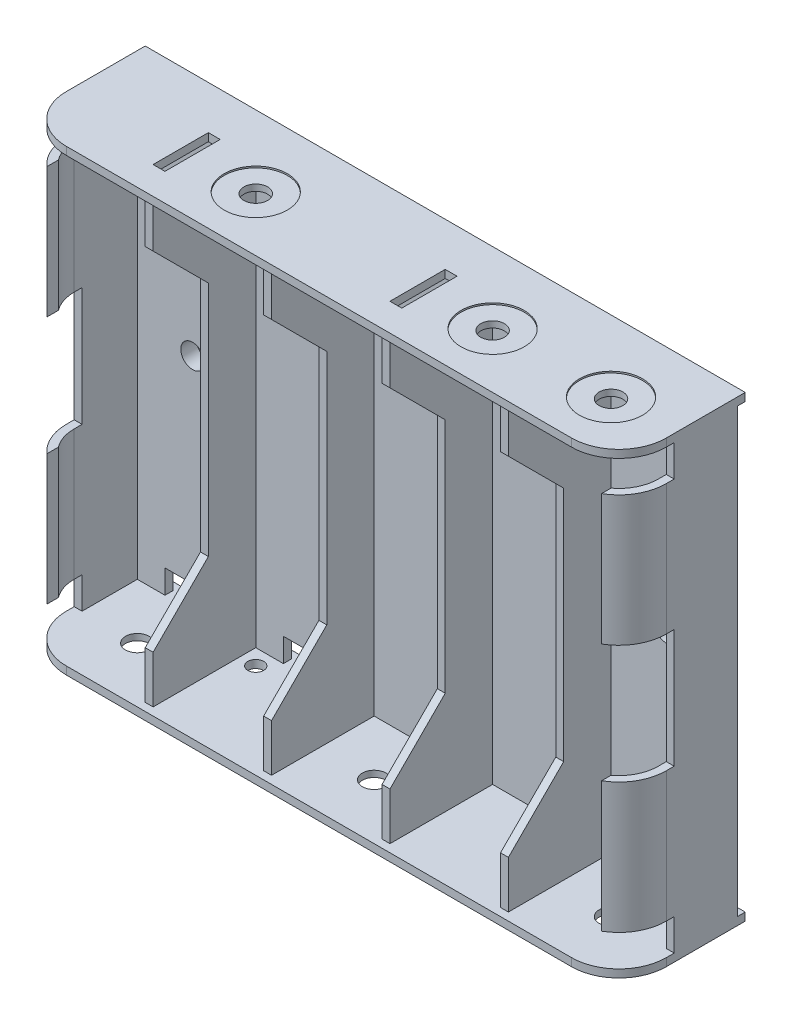
from build123d import *

# Parameters (mm, degrees)
ESQUISSE1_W              = 76
ESQUISSE1_H              = 58
BOSS_EXTRU_1_DEPTH       = 2
ESQUISSE3_W              = 1
ESQUISSE3_H              = 58
BOSS_EXTRU_2_DEPTH       = 13
ENL_V_MAT_EXTRU_2_REACH  = 87.499
ESQUISSE5_W              = 1
ESQUISSE5_H              = 58
BOSS_EXTRU_3_DEPTH       = 13
ENL_V_MAT_EXTRU_3_REACH  = 77.531
ESQUISSE7_W              = 1
ESQUISSE7_H              = 58
BOSS_EXTRU_4_DEPTH       = 13
ENL_V_MAT_EXTRU_4_REACH  = 76.927
ESQUISSE9_W              = 1
ESQUISSE9_H              = 58
BOSS_EXTRU_5_DEPTH       = 13
ENL_V_MAT_EXTRU_5_REACH  = 86.788
ESQUISSE11_W             = 76
ESQUISSE11_H             = 1
BOSS_EXTRU_6_DEPTH       = 14
ESQUISSE12_W             = 76
ESQUISSE12_H             = 1
BOSS_EXTRU_7_DEPTH       = 14
ENL_V_MAT_EXTRU_6_REACH  = 98.933
ENL_V_MAT_EXTRU_7_REACH  = 98.933
ENL_V_MAT_EXTRU_8_REACH  = 98.933
ENL_V_MAT_EXTRU_9_REACH  = 98.933
ESQUISSE18_W             = 76
ESQUISSE18_H             = 56
ENL_V_MAT_EXTRU_10_DEPTH = 1
ESQUISSE19_W             = 1
ESQUISSE19_H             = 56
BOSS_EXTRU_8_DEPTH       = 8
ESQUISSE20_W             = 1
ESQUISSE20_H             = 56
BOSS_EXTRU_9_DEPTH       = 8
BOSS_EXTRU_10_REACH      = 98.338
BOSS_EXTRU_11_REACH      = 98.338
ESQUISSE23_W             = 4
ESQUISSE23_H             = 56
ENL_V_MAT_EXTRU_11_DEPTH = 5
ESQUISSE24_W             = 4
ESQUISSE24_H             = 56
ENL_V_MAT_EXTRU_12_DEPTH = 5
ESQUISSE25_W             = 5.472135955
ESQUISSE25_H             = 4
ESQUISSE25_H_2           = 15
ENL_V_MAT_EXTRU_13_DEPTH = 5
ESQUISSE26_W             = 6.196152423
ESQUISSE26_H             = 4
ESQUISSE26_H_2           = 15
ENL_V_MAT_EXTRU_14_DEPTH = 5
ENL_V_MAT_EXTRU_15_REACH = 98.773
ESQUISSE27_R             = 1.5
ESQUISSE28_R             = 2.5
BOSS_EXTRU_12_DEPTH      = 1
ENL_V_MAT_EXTRU_16_REACH = 98.933
ESQUISSE29_R             = 1.5
ENL_V_MAT_EXTRU_17_REACH = 98.773
ESQUISSE30_W             = 7
ESQUISSE30_H             = 3
BOSS_EXTRU_13_DEPTH      = 1
ENL_V_MAT_EXTRU_18_REACH = 98.933
ESQUISSE32_R             = 1
ESQUISSE33_R             = 4
ENL_V_MAT_EXTRU_19_DEPTH = 0.2
ENL_V_START              = -0.2
ESQUISSE34_R             = 4
ENL_V_MAT_EXTRU_20_DEPTH = 0.2
ENL_V_MAT_EXTRU_21_REACH = 98.813
ESQUISSE35_R             = 1.5
ENL_V_MAT_EXTRU_22_REACH = 98.813
ESQUISSE36_R             = 1.5
ENL_V_MAT_EXTRU_23_REACH = 98.933
ESQUISSE37_W             = 2
ESQUISSE37_H             = 7
ENL_V_MAT_EXTRU_24_REACH = 98.933
ESQUISSE38_W             = 1.5
ESQUISSE38_H             = 7


with BuildPart() as part:
    # Esquisse1 → Boss.-Extru.1 (new body)
    with BuildSketch(Plane.XY):
        with Locations((38, 29)):
            Rectangle(ESQUISSE1_W, ESQUISSE1_H)
    extrude(amount=BOSS_EXTRU_1_DEPTH)

    # Esquisse3 → Boss.-Extru.2 (add)
    with BuildSketch(Plane.XY.offset(2)):
        with Locations((15.5, 29)):
            Rectangle(ESQUISSE3_W, ESQUISSE3_H)
    extrude(amount=BOSS_EXTRU_2_DEPTH)

    # Esquisse4 → Enlèv. mat.-Extru.2 (cut, up to next)
    with BuildSketch(Plane.ZY.offset(-15), mode=Mode.PRIVATE) as enl_v_mat_extru_2_sk1:
        Polygon((15, 51), (8, 44), (8, 14), (15, 7), align=None)
    enl_v_mat_extru_2_tool1 = extrude(enl_v_mat_extru_2_sk1.sketch, amount=-ENL_V_MAT_EXTRU_2_REACH, mode=Mode.PRIVATE) & part.part
    add(enl_v_mat_extru_2_tool1.solids().sort_by_distance((15, 29, 11.720721))[0], mode=Mode.SUBTRACT)

    # Esquisse5 → Boss.-Extru.3 (add)
    with BuildSketch(Plane.XY.offset(2)):
        with Locations((30.5, 29)):
            Rectangle(ESQUISSE5_W, ESQUISSE5_H)
    extrude(amount=BOSS_EXTRU_3_DEPTH)

    # Esquisse6 → Enlèv. mat.-Extru.3 (cut, up to next)
    with BuildSketch(Plane.ZY.offset(-30), mode=Mode.PRIVATE) as enl_v_mat_extru_3_sk1:
        Polygon((15, 51), (8, 44), (8, 14), (15, 7), align=None)
    enl_v_mat_extru_3_tool1 = extrude(enl_v_mat_extru_3_sk1.sketch, amount=-ENL_V_MAT_EXTRU_3_REACH, mode=Mode.PRIVATE) & part.part
    add(enl_v_mat_extru_3_tool1.solids().sort_by_distance((30, 29, 11.720721))[0], mode=Mode.SUBTRACT)

    # Esquisse7 → Boss.-Extru.4 (add)
    with BuildSketch(Plane.XY.offset(2)):
        with Locations((45.5, 29)):
            Rectangle(ESQUISSE7_W, ESQUISSE7_H)
    extrude(amount=BOSS_EXTRU_4_DEPTH)

    # Esquisse8 → Enlèv. mat.-Extru.4 (cut, up to next)
    with BuildSketch(Plane.ZY.offset(-45), mode=Mode.PRIVATE) as enl_v_mat_extru_4_sk1:
        Polygon((15, 51), (8, 44), (8, 14), (15, 7), align=None)
    enl_v_mat_extru_4_tool1 = extrude(enl_v_mat_extru_4_sk1.sketch, amount=-ENL_V_MAT_EXTRU_4_REACH, mode=Mode.PRIVATE) & part.part
    add(enl_v_mat_extru_4_tool1.solids().sort_by_distance((45, 29, 11.720721))[0], mode=Mode.SUBTRACT)

    # Esquisse9 → Boss.-Extru.5 (add)
    with BuildSketch(Plane.XY.offset(2)):
        with Locations((60.5, 29)):
            Rectangle(ESQUISSE9_W, ESQUISSE9_H)
    extrude(amount=BOSS_EXTRU_5_DEPTH)

    # Esquisse10 → Enlèv. mat.-Extru.5 (cut, up to next)
    with BuildSketch(Plane.ZY.offset(-60), mode=Mode.PRIVATE) as enl_v_mat_extru_5_sk1:
        Polygon((15, 51), (8, 44), (8, 14), (15, 7), align=None)
    enl_v_mat_extru_5_tool1 = extrude(enl_v_mat_extru_5_sk1.sketch, amount=-ENL_V_MAT_EXTRU_5_REACH, mode=Mode.PRIVATE) & part.part
    add(enl_v_mat_extru_5_tool1.solids().sort_by_distance((60, 29, 11.720721))[0], mode=Mode.SUBTRACT)

    # Esquisse11 → Boss.-Extru.6 (add)
    with BuildSketch(Plane.XY.offset(2)):
        with Locations((38, 0.5)):
            Rectangle(ESQUISSE11_W, ESQUISSE11_H)
    extrude(amount=BOSS_EXTRU_6_DEPTH)

    # Esquisse12 → Boss.-Extru.7 (add)
    with BuildSketch(Plane.XY.offset(2)):
        with Locations((38, 57.5)):
            Rectangle(ESQUISSE12_W, ESQUISSE12_H)
    extrude(amount=BOSS_EXTRU_7_DEPTH)

    # Esquisse13 → Enlèv. mat.-Extru.6 (cut, up to next)
    with BuildSketch(Plane.XZ, mode=Mode.PRIVATE) as enl_v_mat_extru_6_sk1:
        with BuildLine():
            Line((70, 16), (76, 16))
            Line((76, 16), (76, 10))
            ThreePointArc((76, 10), (74.242640687, 14.242640687), (70, 16))
        make_face()
    enl_v_mat_extru_6_tool1 = extrude(enl_v_mat_extru_6_sk1.sketch, amount=-ENL_V_MAT_EXTRU_6_REACH, mode=Mode.PRIVATE) & part.part
    add(enl_v_mat_extru_6_tool1.solids().sort_by_distance((74.659792, 0, 14.659792))[0], mode=Mode.SUBTRACT)

    # Esquisse14 → Enlèv. mat.-Extru.7 (cut, up to next)
    with BuildSketch(Plane.XZ, mode=Mode.PRIVATE) as enl_v_mat_extru_7_sk1:
        with BuildLine():
            Line((6, 16), (0, 16))
            Line((0, 16), (0, 10))
            ThreePointArc((0, 10), (1.757359313, 14.242640687), (6, 16))
        make_face()
    enl_v_mat_extru_7_tool1 = extrude(enl_v_mat_extru_7_sk1.sketch, amount=-ENL_V_MAT_EXTRU_7_REACH, mode=Mode.PRIVATE) & part.part
    add(enl_v_mat_extru_7_tool1.solids().sort_by_distance((1.340208, 0, 14.659792))[0], mode=Mode.SUBTRACT)

    # Esquisse15 → Enlèv. mat.-Extru.8 (cut, up to next)
    with BuildSketch(Plane(origin=(0, 58, 0), x_dir=(1, 0, 0), z_dir=(0, 1, 0)), mode=Mode.PRIVATE) as enl_v_mat_extru_8_sk1:
        with BuildLine():
            Line((0, -10), (0, -16))
            Line((0, -16), (6, -16))
            ThreePointArc((6, -16), (1.757359313, -14.242640687), (0, -10))
        make_face()
    enl_v_mat_extru_8_tool1 = extrude(enl_v_mat_extru_8_sk1.sketch, amount=-ENL_V_MAT_EXTRU_8_REACH, mode=Mode.PRIVATE) & part.part
    add(enl_v_mat_extru_8_tool1.solids().sort_by_distance((1.340208, 58, 14.659792))[0], mode=Mode.SUBTRACT)

    # Esquisse17 → Enlèv. mat.-Extru.9 (cut, up to next)
    with BuildSketch(Plane(origin=(0, 58, 0), x_dir=(1, 0, 0), z_dir=(0, 1, 0)), mode=Mode.PRIVATE) as enl_v_mat_extru_9_sk1:
        with BuildLine():
            Line((70, -16), (76, -16))
            Line((76, -16), (76, -10))
            ThreePointArc((76, -10), (74.242640687, -14.242640687), (70, -16))
        make_face()
    enl_v_mat_extru_9_tool1 = extrude(enl_v_mat_extru_9_sk1.sketch, amount=-ENL_V_MAT_EXTRU_9_REACH, mode=Mode.PRIVATE) & part.part
    add(enl_v_mat_extru_9_tool1.solids().sort_by_distance((74.659792, 58, 14.659792))[0], mode=Mode.SUBTRACT)

    # Esquisse18 → Enlèv. mat.-Extru.10 (cut)
    with BuildSketch(Plane(origin=(0, 0, 0), x_dir=(-1, 0, 0), z_dir=(0, 0, -1))):
        with Locations((-38, 29)):
            Rectangle(ESQUISSE18_W, ESQUISSE18_H)
    extrude(amount=-ENL_V_MAT_EXTRU_10_DEPTH, mode=Mode.SUBTRACT)

    # Esquisse19 → Boss.-Extru.8 (add)
    with BuildSketch(Plane.XY.offset(2)):
        with Locations((75.5, 29)):
            Rectangle(ESQUISSE19_W, ESQUISSE19_H)
    extrude(amount=BOSS_EXTRU_8_DEPTH)

    # Esquisse20 → Boss.-Extru.9 (add)
    with BuildSketch(Plane.XY.offset(2)):
        with Locations((0.5, 29)):
            Rectangle(ESQUISSE20_W, ESQUISSE20_H)
    extrude(amount=BOSS_EXTRU_9_DEPTH)

    # Esquisse21 → Boss.-Extru.10 (add, up to next)
    with BuildSketch(Plane.XZ.offset(-57), mode=Mode.PRIVATE) as boss_extru_10_sk1:
        with BuildLine():
            Line((6, 15), (6, 16))
            ThreePointArc((6, 16), (1.757359313, 14.242640687), (0, 10))
            Line((0, 10), (1, 10))
            ThreePointArc((1, 10), (2.464466094, 13.535533906), (6, 15))
        make_face()
    boss_extru_10_tool1 = extrude(boss_extru_10_sk1.sketch, amount=BOSS_EXTRU_10_REACH, mode=Mode.PRIVATE) - part.part
    add(boss_extru_10_tool1.solids().sort_by_distance((0.5, 57, 10.084853))[0])

    # Esquisse22 → Boss.-Extru.11 (add, up to next)
    with BuildSketch(Plane(origin=(0, 1, 0), x_dir=(1, 0, 0), z_dir=(0, 1, 0)), mode=Mode.PRIVATE) as boss_extru_11_sk1:
        with BuildLine():
            Line((70, -16), (70, -15))
            ThreePointArc((70, -15), (73.535533906, -13.535533906), (75, -10))
            Line((75, -10), (76, -10))
            ThreePointArc((76, -10), (74.242640687, -14.242640687), (70, -16))
        make_face()
    boss_extru_11_tool1 = extrude(boss_extru_11_sk1.sketch, amount=BOSS_EXTRU_11_REACH, mode=Mode.PRIVATE) - part.part
    add(boss_extru_11_tool1.solids().sort_by_distance((74.182641, 1, 14.182641))[0])

    # Esquisse23 → Enlèv. mat.-Extru.11 (cut)
    with BuildSketch(Plane.XY.offset(16)):
        with Locations((71, 29)):
            Rectangle(ESQUISSE23_W, ESQUISSE23_H)
    extrude(amount=-ENL_V_MAT_EXTRU_11_DEPTH, mode=Mode.SUBTRACT)

    # Esquisse24 → Enlèv. mat.-Extru.12 (cut)
    with BuildSketch(Plane.XY.offset(16)):
        with Locations((4, 29)):
            Rectangle(ESQUISSE24_W, ESQUISSE24_H)
    extrude(amount=-ENL_V_MAT_EXTRU_12_DEPTH, mode=Mode.SUBTRACT)

    # Esquisse25 → Enlèv. mat.-Extru.13 (cut)
    with BuildSketch(Plane.ZY):
        with Locations((11.736067977, 55)):
            Rectangle(ESQUISSE25_W, ESQUISSE25_H)
        with Locations((11.736067977, 29)):
            Rectangle(ESQUISSE25_W, ESQUISSE25_H_2)
        with Locations((11.736067977, 3)):
            Rectangle(ESQUISSE25_W, ESQUISSE25_H)
    extrude(amount=-ENL_V_MAT_EXTRU_13_DEPTH, mode=Mode.SUBTRACT)

    # Esquisse26 → Enlèv. mat.-Extru.14 (cut)
    with BuildSketch(Plane(origin=(76, 0, 0), x_dir=(0, 0, -1), z_dir=(1, 0, 0))):
        with Locations((-12.098076212, 55)):
            Rectangle(ESQUISSE26_W, ESQUISSE26_H)
        with Locations((-12.098076212, 29)):
            Rectangle(ESQUISSE26_W, ESQUISSE26_H_2)
        with Locations((-12.098076212, 3)):
            Rectangle(ESQUISSE26_W, ESQUISSE26_H)
    extrude(amount=-ENL_V_MAT_EXTRU_14_DEPTH, mode=Mode.SUBTRACT)

    # Esquisse27 → Enlèv. mat.-Extru.15 (cut, up to next)
    with BuildSketch(Plane(origin=(0, 0, 1), x_dir=(-1, 0, 0), z_dir=(0, 0, -1)), mode=Mode.PRIVATE) as enl_v_mat_extru_15_sk1:
        with Locations((-68, 29)):
            Circle(ESQUISSE27_R)
    enl_v_mat_extru_15_tool1 = extrude(enl_v_mat_extru_15_sk1.sketch, amount=-ENL_V_MAT_EXTRU_15_REACH, mode=Mode.PRIVATE) & part.part
    # Esquisse27 → Enlèv. mat.-Extru.15 (cut, up to next)
    with BuildSketch(Plane(origin=(0, 0, 1), x_dir=(-1, 0, 0), z_dir=(0, 0, -1)), mode=Mode.PRIVATE) as enl_v_mat_extru_15_sk2:
        with Locations((-8, 29)):
            Circle(ESQUISSE27_R)
    enl_v_mat_extru_15_tool2 = extrude(enl_v_mat_extru_15_sk2.sketch, amount=-ENL_V_MAT_EXTRU_15_REACH, mode=Mode.PRIVATE) & part.part
    add(enl_v_mat_extru_15_tool1.solids().sort_by_distance((68, 29, 1))[0], mode=Mode.SUBTRACT)
    add(enl_v_mat_extru_15_tool2.solids().sort_by_distance((8, 29, 1))[0], mode=Mode.SUBTRACT)

    # Esquisse28 → Boss.-Extru.12 (add)
    with BuildSketch(Plane(origin=(0, 0, 1), x_dir=(-1, 0, 0), z_dir=(0, 0, -1))):
        with Locations((-68, 29)):
            Circle(ESQUISSE28_R)
        with Locations((-8, 29)):
            Circle(ESQUISSE28_R)
    extrude(amount=BOSS_EXTRU_12_DEPTH)

    # Esquisse29 → Enlèv. mat.-Extru.16 (cut, up to next)
    with BuildSketch(Plane(origin=(0, 0, 0), x_dir=(-1, 0, 0), z_dir=(0, 0, -1)), mode=Mode.PRIVATE) as enl_v_mat_extru_16_sk1:
        with Locations((-68, 29)):
            Circle(ESQUISSE29_R)
    enl_v_mat_extru_16_tool1 = extrude(enl_v_mat_extru_16_sk1.sketch, amount=-ENL_V_MAT_EXTRU_16_REACH, mode=Mode.PRIVATE) & part.part
    # Esquisse29 → Enlèv. mat.-Extru.16 (cut, up to next)
    with BuildSketch(Plane(origin=(0, 0, 0), x_dir=(-1, 0, 0), z_dir=(0, 0, -1)), mode=Mode.PRIVATE) as enl_v_mat_extru_16_sk2:
        with Locations((-8, 29)):
            Circle(ESQUISSE29_R)
    enl_v_mat_extru_16_tool2 = extrude(enl_v_mat_extru_16_sk2.sketch, amount=-ENL_V_MAT_EXTRU_16_REACH, mode=Mode.PRIVATE) & part.part
    add(enl_v_mat_extru_16_tool1.solids().sort_by_distance((68, 29, 0))[0], mode=Mode.SUBTRACT)
    add(enl_v_mat_extru_16_tool2.solids().sort_by_distance((8, 29, 0))[0], mode=Mode.SUBTRACT)

    # Esquisse30 → Enlèv. mat.-Extru.17 (cut, up to next)
    with BuildSketch(Plane(origin=(0, 0, 1), x_dir=(-1, 0, 0), z_dir=(0, 0, -1)), mode=Mode.PRIVATE) as enl_v_mat_extru_17_sk1:
        with Locations((-68, 55.5)):
            Rectangle(ESQUISSE30_W, ESQUISSE30_H)
    enl_v_mat_extru_17_tool1 = extrude(enl_v_mat_extru_17_sk1.sketch, amount=-ENL_V_MAT_EXTRU_17_REACH, mode=Mode.PRIVATE) & part.part
    # Esquisse30 → Enlèv. mat.-Extru.17 (cut, up to next)
    with BuildSketch(Plane(origin=(0, 0, 1), x_dir=(-1, 0, 0), z_dir=(0, 0, -1)), mode=Mode.PRIVATE) as enl_v_mat_extru_17_sk2:
        with Locations((-8, 2.5)):
            Rectangle(ESQUISSE30_W, ESQUISSE30_H)
    enl_v_mat_extru_17_tool2 = extrude(enl_v_mat_extru_17_sk2.sketch, amount=-ENL_V_MAT_EXTRU_17_REACH, mode=Mode.PRIVATE) & part.part
    # Esquisse30 → Enlèv. mat.-Extru.17 (cut, up to next)
    with BuildSketch(Plane(origin=(0, 0, 1), x_dir=(-1, 0, 0), z_dir=(0, 0, -1)), mode=Mode.PRIVATE) as enl_v_mat_extru_17_sk3:
        with Locations((-23, 2.5)):
            Rectangle(ESQUISSE30_W, ESQUISSE30_H)
    enl_v_mat_extru_17_tool3 = extrude(enl_v_mat_extru_17_sk3.sketch, amount=-ENL_V_MAT_EXTRU_17_REACH, mode=Mode.PRIVATE) & part.part
    add(enl_v_mat_extru_17_tool1.solids().sort_by_distance((68, 55.5, 1))[0], mode=Mode.SUBTRACT)
    add(enl_v_mat_extru_17_tool2.solids().sort_by_distance((8, 2.5, 1))[0], mode=Mode.SUBTRACT)
    add(enl_v_mat_extru_17_tool3.solids().sort_by_distance((23, 2.5, 1))[0], mode=Mode.SUBTRACT)

    # Esquisse31 → Boss.-Extru.13 (add)
    with BuildSketch(Plane(origin=(0, 0, 1), x_dir=(-1, 0, 0), z_dir=(0, 0, -1))):
        Polygon((-21, 4), (-66, 54), (-64.654637595, 54), (-19.654637595, 4), align=None)
        Polygon((-22.345362405, 4), (-67.345362405, 54), (-68.690724809, 54), (-23.690724809, 4), align=None)
    extrude(amount=BOSS_EXTRU_13_DEPTH)

    # Esquisse32 → Enlèv. mat.-Extru.18 (cut, up to next)
    with BuildSketch(Plane.XZ, mode=Mode.PRIVATE) as enl_v_mat_extru_18_sk1:
        with Locations(Location((14, 4, 0), (0, 0, 270))):
            Circle(ESQUISSE32_R)
    enl_v_mat_extru_18_tool1 = extrude(enl_v_mat_extru_18_sk1.sketch, amount=-ENL_V_MAT_EXTRU_18_REACH, mode=Mode.PRIVATE) & part.part
    # Esquisse32 → Enlèv. mat.-Extru.18 (cut, up to next)
    with BuildSketch(Plane.XZ, mode=Mode.PRIVATE) as enl_v_mat_extru_18_sk2:
        with Locations(Location((18, 4, 0), (0, 0, 270))):
            Circle(ESQUISSE32_R)
    enl_v_mat_extru_18_tool2 = extrude(enl_v_mat_extru_18_sk2.sketch, amount=-ENL_V_MAT_EXTRU_18_REACH, mode=Mode.PRIVATE) & part.part
    add(enl_v_mat_extru_18_tool1.solids().sort_by_distance((14, 0, 4))[0], mode=Mode.SUBTRACT)
    add(enl_v_mat_extru_18_tool2.solids().sort_by_distance((18, 0, 4))[0], mode=Mode.SUBTRACT)

    # Esquisse33 → Enlèv. mat.-Extru.19 (cut)
    with BuildSketch(Plane(origin=(0, 58, 0), x_dir=(1, 0, 0), z_dir=(0, 1, 0))):
        with Locations(Location((68, -9, 0), (0, 0, 270))):
            Circle(ESQUISSE33_R)
        with Locations(Location((53, -9, 0), (0, 0, 270))):
            Circle(ESQUISSE33_R)
        with Locations(Location((23, -9, 0), (0, 0, 270))):
            Circle(ESQUISSE33_R)
    extrude(amount=-ENL_V_MAT_EXTRU_19_DEPTH, mode=Mode.SUBTRACT)

    # Esquisse34 → Enlèv. mat.-Extru.20 (cut)
    with BuildSketch(Plane.XZ.offset(ENL_V_START)):
        with Locations(Location((8, 9, 0), (0, 0, 270))):
            Circle(ESQUISSE34_R)
        with Locations(Location((38, 9, 0), (0, 0, 270))):
            Circle(ESQUISSE34_R)
        with Locations(Location((68, 9, 0), (0, 0, 90))):
            Circle(ESQUISSE34_R)
    extrude(amount=ENL_V_MAT_EXTRU_20_DEPTH, mode=Mode.SUBTRACT)

    # Esquisse35 → Enlèv. mat.-Extru.21 (cut, up to next)
    with BuildSketch(Plane.XZ.offset(-0.2), mode=Mode.PRIVATE) as enl_v_mat_extru_21_sk1:
        with Locations(Location((38, 9, 0), (0, 0, 270))):
            Circle(ESQUISSE35_R)
    enl_v_mat_extru_21_tool1 = extrude(enl_v_mat_extru_21_sk1.sketch, amount=-ENL_V_MAT_EXTRU_21_REACH, mode=Mode.PRIVATE) & part.part
    # Esquisse35 → Enlèv. mat.-Extru.21 (cut, up to next)
    with BuildSketch(Plane.XZ.offset(-0.2), mode=Mode.PRIVATE) as enl_v_mat_extru_21_sk2:
        with Locations(Location((68, 9, 0), (0, 0, 270))):
            Circle(ESQUISSE35_R)
    enl_v_mat_extru_21_tool2 = extrude(enl_v_mat_extru_21_sk2.sketch, amount=-ENL_V_MAT_EXTRU_21_REACH, mode=Mode.PRIVATE) & part.part
    # Esquisse35 → Enlèv. mat.-Extru.21 (cut, up to next)
    with BuildSketch(Plane.XZ.offset(-0.2), mode=Mode.PRIVATE) as enl_v_mat_extru_21_sk3:
        with Locations(Location((8, 9, 0), (0, 0, 270))):
            Circle(ESQUISSE35_R)
    enl_v_mat_extru_21_tool3 = extrude(enl_v_mat_extru_21_sk3.sketch, amount=-ENL_V_MAT_EXTRU_21_REACH, mode=Mode.PRIVATE) & part.part
    add(enl_v_mat_extru_21_tool1.solids().sort_by_distance((38, 0.2, 9))[0], mode=Mode.SUBTRACT)
    add(enl_v_mat_extru_21_tool2.solids().sort_by_distance((68, 0.2, 9))[0], mode=Mode.SUBTRACT)
    add(enl_v_mat_extru_21_tool3.solids().sort_by_distance((8, 0.2, 9))[0], mode=Mode.SUBTRACT)

    # Esquisse36 → Enlèv. mat.-Extru.22 (cut, up to next)
    with BuildSketch(Plane(origin=(0, 57.8, 0), x_dir=(1, 0, 0), z_dir=(0, 1, 0)), mode=Mode.PRIVATE) as enl_v_mat_extru_22_sk1:
        with Locations(Location((68, -9, 0), (0, 0, 90))):
            Circle(ESQUISSE36_R)
    enl_v_mat_extru_22_tool1 = extrude(enl_v_mat_extru_22_sk1.sketch, amount=-ENL_V_MAT_EXTRU_22_REACH, mode=Mode.PRIVATE) & part.part
    # Esquisse36 → Enlèv. mat.-Extru.22 (cut, up to next)
    with BuildSketch(Plane(origin=(0, 57.8, 0), x_dir=(1, 0, 0), z_dir=(0, 1, 0)), mode=Mode.PRIVATE) as enl_v_mat_extru_22_sk2:
        with Locations(Location((53, -9, 0), (0, 0, 270))):
            Circle(ESQUISSE36_R)
    enl_v_mat_extru_22_tool2 = extrude(enl_v_mat_extru_22_sk2.sketch, amount=-ENL_V_MAT_EXTRU_22_REACH, mode=Mode.PRIVATE) & part.part
    # Esquisse36 → Enlèv. mat.-Extru.22 (cut, up to next)
    with BuildSketch(Plane(origin=(0, 57.8, 0), x_dir=(1, 0, 0), z_dir=(0, 1, 0)), mode=Mode.PRIVATE) as enl_v_mat_extru_22_sk3:
        with Locations(Location((23, -9, 0), (0, 0, 270))):
            Circle(ESQUISSE36_R)
    enl_v_mat_extru_22_tool3 = extrude(enl_v_mat_extru_22_sk3.sketch, amount=-ENL_V_MAT_EXTRU_22_REACH, mode=Mode.PRIVATE) & part.part
    add(enl_v_mat_extru_22_tool1.solids().sort_by_distance((68, 57.8, 9))[0], mode=Mode.SUBTRACT)
    add(enl_v_mat_extru_22_tool2.solids().sort_by_distance((53, 57.8, 9))[0], mode=Mode.SUBTRACT)
    add(enl_v_mat_extru_22_tool3.solids().sort_by_distance((23, 57.8, 9))[0], mode=Mode.SUBTRACT)

    # Esquisse37 → Enlèv. mat.-Extru.23 (cut, up to next)
    with BuildSketch(Plane.XZ, mode=Mode.PRIVATE) as enl_v_mat_extru_23_sk1:
        with Locations((59, 9)):
            Rectangle(ESQUISSE37_W, ESQUISSE37_H)
    enl_v_mat_extru_23_tool1 = extrude(enl_v_mat_extru_23_sk1.sketch, amount=-ENL_V_MAT_EXTRU_23_REACH, mode=Mode.PRIVATE) & part.part
    # Esquisse37 → Enlèv. mat.-Extru.23 (cut, up to next)
    with BuildSketch(Plane.XZ, mode=Mode.PRIVATE) as enl_v_mat_extru_23_sk2:
        with Locations((29, 9)):
            Rectangle(ESQUISSE37_W, ESQUISSE37_H)
    enl_v_mat_extru_23_tool2 = extrude(enl_v_mat_extru_23_sk2.sketch, amount=-ENL_V_MAT_EXTRU_23_REACH, mode=Mode.PRIVATE) & part.part
    add(enl_v_mat_extru_23_tool1.solids().sort_by_distance((59, 0, 9))[0], mode=Mode.SUBTRACT)
    add(enl_v_mat_extru_23_tool2.solids().sort_by_distance((29, 0, 9))[0], mode=Mode.SUBTRACT)

    # Esquisse38 → Enlèv. mat.-Extru.24 (cut, up to next)
    with BuildSketch(Plane(origin=(0, 58, 0), x_dir=(1, 0, 0), z_dir=(0, 1, 0)), mode=Mode.PRIVATE) as enl_v_mat_extru_24_sk1:
        with Locations((44.25, -9.00324579)):
            Rectangle(ESQUISSE38_W, ESQUISSE38_H)
    enl_v_mat_extru_24_tool1 = extrude(enl_v_mat_extru_24_sk1.sketch, amount=-ENL_V_MAT_EXTRU_24_REACH, mode=Mode.PRIVATE) & part.part
    # Esquisse38 → Enlèv. mat.-Extru.24 (cut, up to next)
    with BuildSketch(Plane(origin=(0, 58, 0), x_dir=(1, 0, 0), z_dir=(0, 1, 0)), mode=Mode.PRIVATE) as enl_v_mat_extru_24_sk2:
        with Locations((14.25, -9.00324579)):
            Rectangle(ESQUISSE38_W, ESQUISSE38_H)
    enl_v_mat_extru_24_tool2 = extrude(enl_v_mat_extru_24_sk2.sketch, amount=-ENL_V_MAT_EXTRU_24_REACH, mode=Mode.PRIVATE) & part.part
    add(enl_v_mat_extru_24_tool1.solids().sort_by_distance((44.25, 58, 9.003246))[0], mode=Mode.SUBTRACT)
    add(enl_v_mat_extru_24_tool2.solids().sort_by_distance((14.25, 58, 9.003246))[0], mode=Mode.SUBTRACT)


solid = part.part
